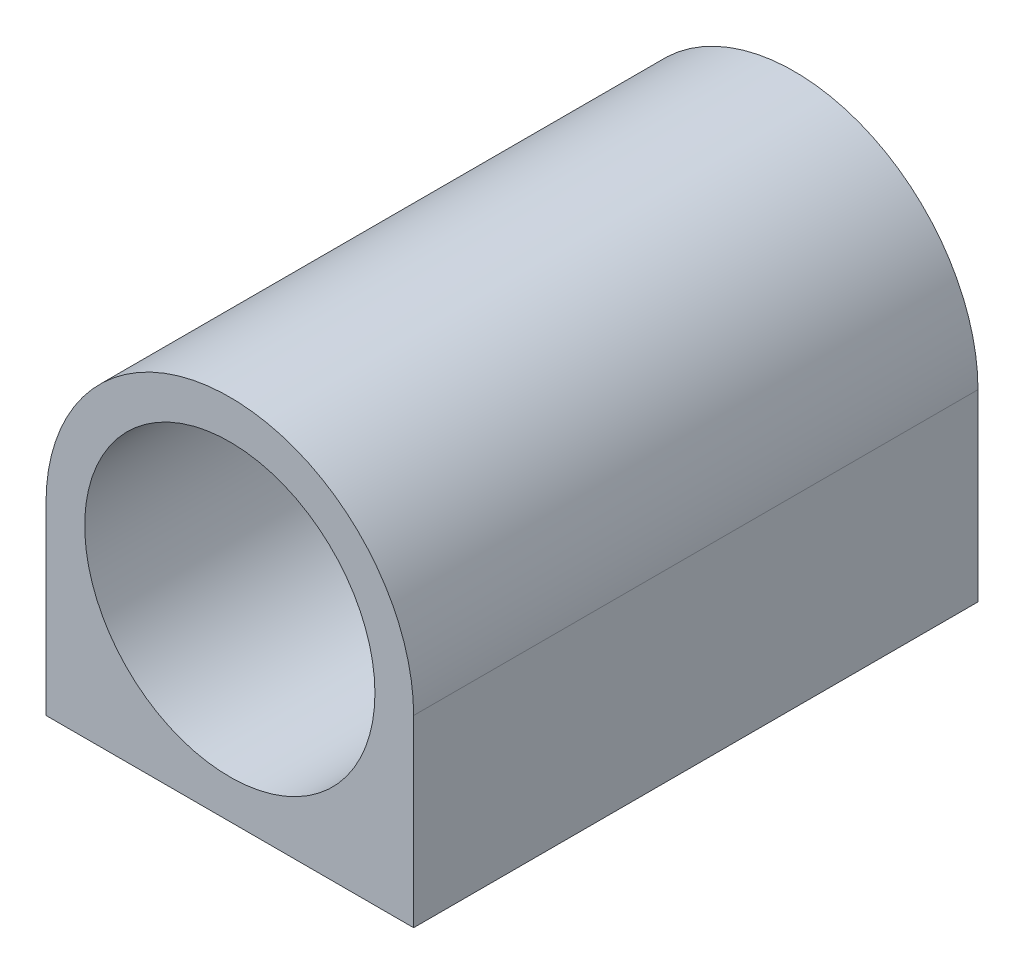
from build123d import *

# Parameters (mm, degrees)
SKETCH1_R           = 9
BOSS_EXTRUDE1_DEPTH = 35


with BuildPart() as part:
    # Sketch1 → Boss-Extrude1 (new body)
    with BuildSketch(Plane.XY):
        with BuildLine():
            Line((0, 0), (22.8, 0))
            Line((22.8, 0), (22.8, 11.4))
            ThreePointArc((22.8, 11.4), (11.4, 22.8), (0, 11.4))
            Line((0, 11.4), (0, 0))
        make_face()
        with Locations((11.4, 11.4)):
            Circle(SKETCH1_R, mode=Mode.SUBTRACT)
    extrude(amount=BOSS_EXTRUDE1_DEPTH)


solid = part.part
